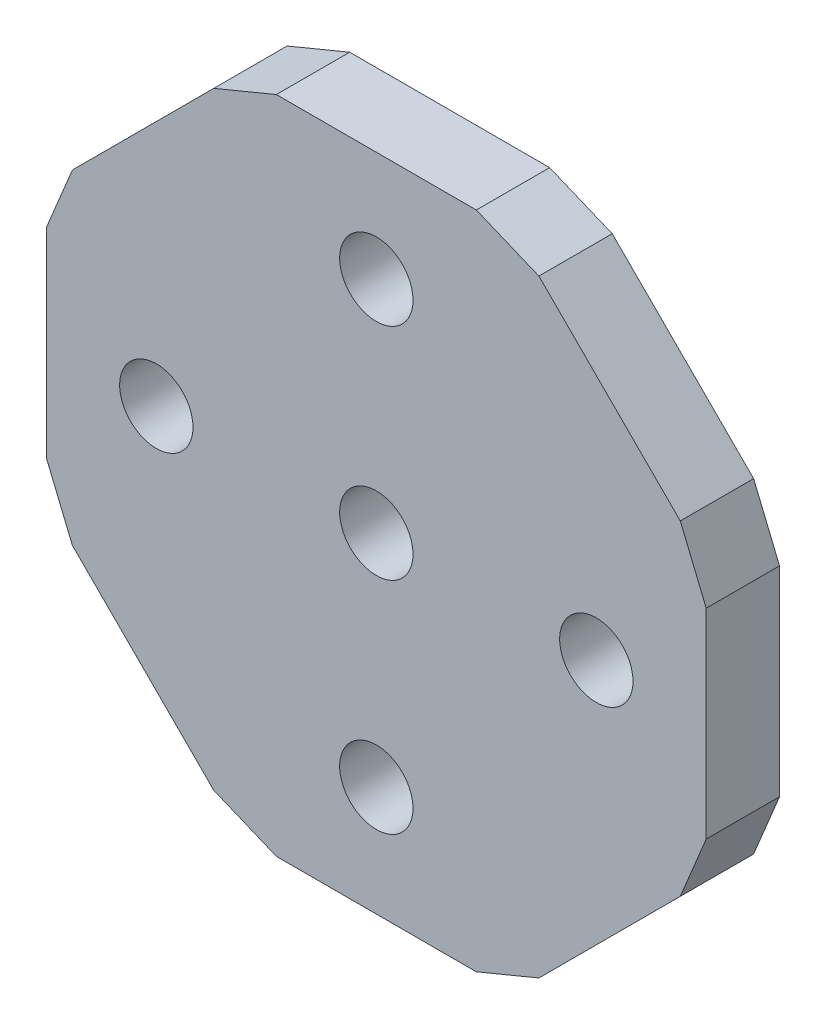
from build123d import *

# Parameters (mm, degrees)
MODEL_R                 = 1.5
SALIENTE_EXTRUIR1_DEPTH = 3


with BuildPart() as part:
    # Model → Saliente-Extruir1 (new body)
    with BuildSketch(Plane.XY):
        Polygon((219.837619938, 228.457019993), (211.657995889, 228.457019993), (209.097335717, 229.517680165), (203.313468085, 235.301547797), (202.252807913, 237.862207969), (202.252807913, 246.041832017), (203.313468085, 248.602492189), (209.097335717, 254.386359821), (211.657995889, 255.447019993), (219.837619938, 255.447019993), (222.39828011, 254.386359821), (228.182147742, 248.602492189), (229.242807914, 246.041832017), (229.242807914, 237.862207969), (228.182147742, 235.301547797), (222.39828011, 229.517680165), align=None)
        with Locations((215.747807914, 241.952019993)):
            Circle(MODEL_R, mode=Mode.SUBTRACT)
        with Locations((215.747807914, 232.952019993)):
            Circle(MODEL_R, mode=Mode.SUBTRACT)
        with Locations((215.747807914, 250.952019993)):
            Circle(MODEL_R, mode=Mode.SUBTRACT)
        with Locations((224.747807913, 241.952019993)):
            Circle(MODEL_R, mode=Mode.SUBTRACT)
        with Locations((206.747807913, 241.952019993)):
            Circle(MODEL_R, mode=Mode.SUBTRACT)
    extrude(amount=SALIENTE_EXTRUIR1_DEPTH)


solid = part.part
